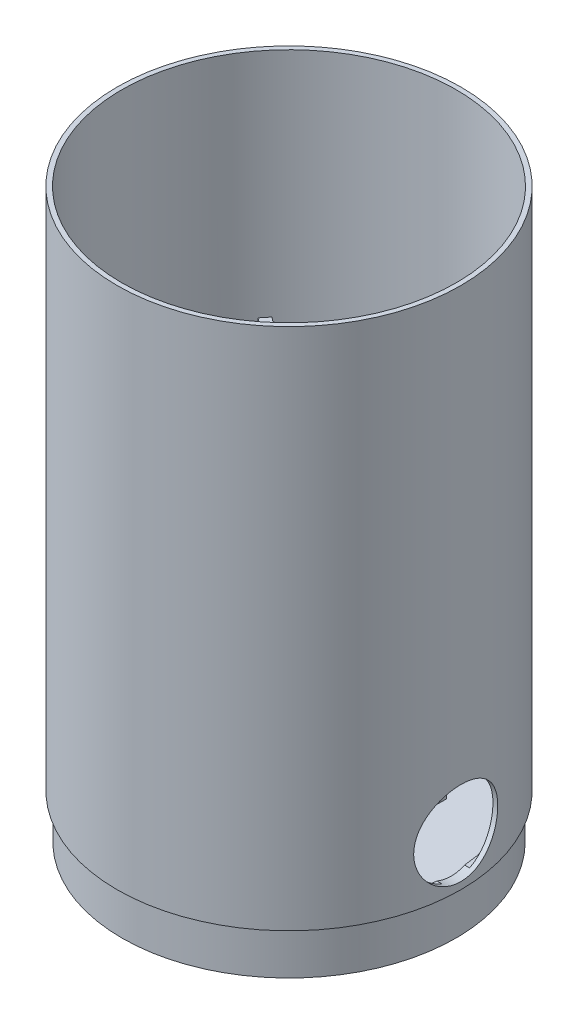
from build123d import *

# Parameters (mm, degrees)
SKETCH1_R           = 35.75
SKETCH1_R_2         = 34.75
BOSS_EXTRUDE1_DEPTH = 9.5
SKETCH3_R           = 34.75
BOSS_EXTRUDE2_DEPTH = 2
SKETCH4_W           = 38.5
SKETCH4_H           = 45.5
SKETCH4_W_2         = 36.5
SKETCH4_H_2         = 43.5
BOSS_EXTRUDE3_DEPTH = 70
SKETCH2_R           = 36.8
SKETCH2_R_2         = 34.75
BOSS_EXTRUDE4_DEPTH = 2
SKETCH5_R           = 36.8
SKETCH5_R_2         = 35.8
BOSS_EXTRUDE5_DEPTH = 110
BOSS_EXTRUDE6_START = -60.5
BOSS_EXTRUDE6_DEPTH = 60.5
SKETCH7_R           = 9
CUT_EXTRUDE1_DEPTH  = 5
BOSS_EXTRUDE7_DEPTH = 50


with BuildPart() as part:
    # Sketch1 → Boss-Extrude1 (new body)
    with BuildSketch(Plane(origin=(0, 0, 0), x_dir=(1, 0, 0), z_dir=(0, 1, 0))):
        with Locations(Location((0, 0, 0), (0, 0, 270))):
            Circle(SKETCH1_R)
        with Locations(Location((0, 0, 0), (0, 0, 270))):
            Circle(SKETCH1_R_2, mode=Mode.SUBTRACT)
    extrude(amount=BOSS_EXTRUDE1_DEPTH)

    # Sketch3 → Boss-Extrude2 (add)
    with BuildSketch(Plane.XZ):
        with Locations(Location((0, 0, 0), (0, 0, 270))):
            Circle(SKETCH3_R)
    extrude(amount=-BOSS_EXTRUDE2_DEPTH)

    # Sketch4 → Boss-Extrude3 (add)
    with BuildSketch(Plane(origin=(0, 2, 0), x_dir=(1, 0, 0), z_dir=(0, 1, 0))):
        with Locations((-8.327164466, 0)):
            Rectangle(SKETCH4_W, SKETCH4_H)
        with Locations((-8.327164466, 0)):
            Rectangle(SKETCH4_W_2, SKETCH4_H_2, mode=Mode.SUBTRACT)
    extrude(amount=BOSS_EXTRUDE3_DEPTH)

    # Sketch2 → Boss-Extrude4 (add)
    with BuildSketch(Plane(origin=(0, 9.5, 0), x_dir=(1, 0, 0), z_dir=(0, 1, 0))):
        with Locations(Location((0, 0, 0), (0, 0, 270))):
            Circle(SKETCH2_R)
        Circle(SKETCH2_R_2, mode=Mode.SUBTRACT)
    extrude(amount=BOSS_EXTRUDE4_DEPTH)

    # Sketch5 → Boss-Extrude5 (add)
    with BuildSketch(Plane(origin=(0, 11.5, 0), x_dir=(1, 0, 0), z_dir=(0, 1, 0))):
        with Locations(Location((0, 0, 0), (0, 0, 270))):
            Circle(SKETCH5_R)
        with Locations(Location((0, 0, 0), (0, 0, 270))):
            Circle(SKETCH5_R_2, mode=Mode.SUBTRACT)
    extrude(amount=BOSS_EXTRUDE5_DEPTH)

    # Sketch6 → Boss-Extrude6 (add)
    with BuildSketch(Plane(origin=(0, 72, 0), x_dir=(1, 0, 0), z_dir=(0, 1, 0)).offset(BOSS_EXTRUDE6_START)):
        with BuildLine():
            Line((-26.267851073, 22.75), (-27.061555926, 23.437410072))
            ThreePointArc((-27.061555926, 23.437410072), (-27.748330258, 22.620127494), (-28.410431306, 21.782731532))
            Line((-28.410431306, 21.782731532), (-27.577164466, 21.143852534))
            Line((-27.577164466, 21.143852534), (-26.267851073, 22.75))
        make_face()
        with BuildLine():
            Line((-26.267851073, -22.75), (-27.061555926, -23.437410072))
            ThreePointArc((-27.061555926, -23.437410072), (-27.748330258, -22.620127494), (-28.410431306, -21.782731532))
            Line((-28.410431306, -21.782731532), (-27.577164466, -21.143852534))
            Line((-27.577164466, -21.143852534), (-26.267851073, -22.75))
        make_face()
    extrude(amount=BOSS_EXTRUDE6_DEPTH)

    # Sketch7 → Cut-Extrude1 (cut)
    with BuildSketch(Plane(origin=(36.8, 0, 0), x_dir=(0, 0, -1), z_dir=(1, 0, 0))):
        with Locations((0, 20)):
            Circle(SKETCH7_R)
    extrude(amount=-CUT_EXTRUDE1_DEPTH, mode=Mode.SUBTRACT)

    # Sketch8 → Boss-Extrude7 (add)
    with BuildSketch(Plane(origin=(0, 72, 0), x_dir=(1, 0, 0), z_dir=(0, 1, 0))):
        Polygon((10.276388924, 21.396446609), (19.780640943, 30.900698628), (18.782256531, 31.316527778), (9.569282143, 22.103553391), align=None)
        Polygon((9.569282143, -22.103553391), (10.276388924, -21.396446609), (19.780640943, -30.900698628), (18.782256531, -31.316527778), align=None)
    extrude(amount=-BOSS_EXTRUDE7_DEPTH)


solid = part.part
